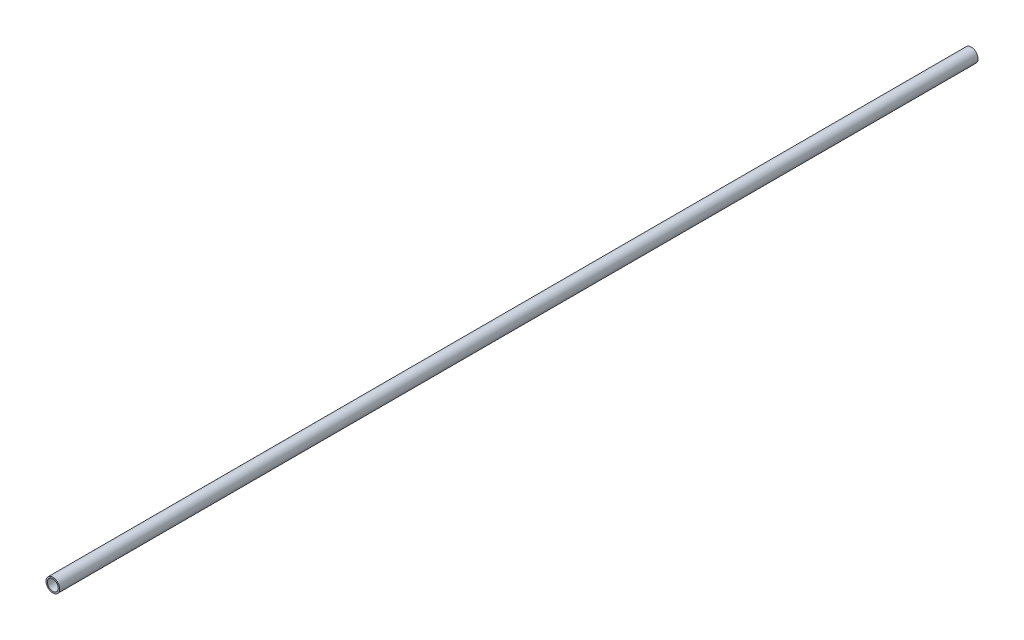
from build123d import *

# Parameters (mm, degrees)
SKETCH1_R      = 5
SKETCH1_R_2    = 4
EXTRUDE1_DEPTH = 673


with BuildPart() as part:
    # Sketch1 → Extrude1 (new body)
    with BuildSketch(Plane.XY):
        Circle(SKETCH1_R)
        Circle(SKETCH1_R_2, mode=Mode.SUBTRACT)
    extrude(amount=EXTRUDE1_DEPTH)


solid = part.part
